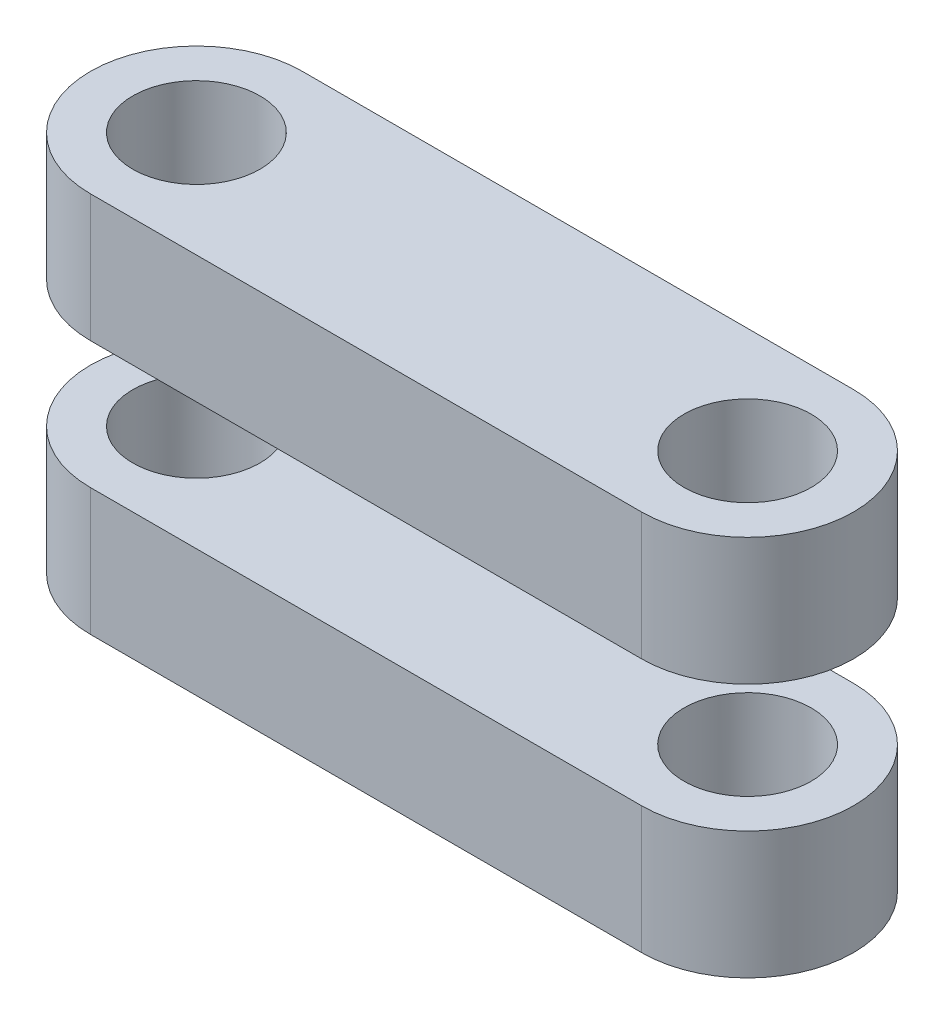
from build123d import *

# Parameters (mm, degrees)
SKETCH1_R           = 1.5
BOSS_EXTRUDE1_DEPTH = 9
SKETCH2_W           = 6
SKETCH2_H           = 3
CUT_EXTRUDE1_DEPTH  = 19.607794066
CHAMFER1_SIZE       = 1
SKETCH3_W           = 5
SKETCH3_H           = 3
CUT_EXTRUDE2_DEPTH  = 9


with BuildPart() as part:
    # Sketch1 → Boss-Extrude1 (new body)
    with BuildSketch(Plane(origin=(0, 0, 0), x_dir=(1, 0, 0), z_dir=(0, 1, 0))):
        with BuildLine():
            Line((0, 2.5), (13, 2.5))
            ThreePointArc((13, 2.5), (15.5, 0), (13, -2.5))
            Line((13, -2.5), (0, -2.5))
            ThreePointArc((0, -2.5), (-2.5, 0), (0, 2.5))
        make_face()
        with Locations(Location((0, 0, 0), (0, 0, 270))):
            Circle(SKETCH1_R, mode=Mode.SUBTRACT)
        with Locations(Location((13, 0, 0), (0, 0, 270))):
            Circle(SKETCH1_R, mode=Mode.SUBTRACT)
    extrude(amount=BOSS_EXTRUDE1_DEPTH)

    # Sketch2 → Cut-Extrude1 (cut, through all)
    with BuildSketch(Plane(origin=(0, 0, -2.5), x_dir=(-1, 0, 0), z_dir=(0, 0, -1))):
        with Locations((-13, 4.5)):
            Rectangle(SKETCH2_W, SKETCH2_H)
        with Locations((0, 4.5)):
            Rectangle(SKETCH2_W, SKETCH2_H)
    extrude(amount=-CUT_EXTRUDE1_DEPTH, mode=Mode.SUBTRACT)

    # Chamfer1
    chamfer1_edges = [part.edges().sort_by_distance(p)[0] for p in [
        (10, 4.5, 2.5),
        (10, 4.5, -2.5),
        (3, 4.5, -2.5),
        (3, 4.5, 2.5),
    ]]
    chamfer(chamfer1_edges, length=CHAMFER1_SIZE)

    # Sketch3 → Cut-Extrude2 (cut)
    with BuildSketch(Plane.ZY.offset(-3)):
        with Locations((0, 4.5)):
            Rectangle(SKETCH3_W, SKETCH3_H)
    extrude(amount=-CUT_EXTRUDE2_DEPTH, mode=Mode.SUBTRACT)


with BuildPart() as cut_extrude2_piece_1:
    # of the separate pieces the step leaves, piece 1, a body of its own (cut_extrude2_pieces)
    add(part.part.solids().sort_by_distance((13, 6, -2.5))[0])


with BuildPart() as cut_extrude2_piece_2:
    # of the separate pieces the step leaves, piece 2, a body of its own (cut_extrude2_pieces)
    add(part.part.solids().sort_by_distance((0, 3, -2.5))[0])


solid = Compound([cut_extrude2_piece_1.part, cut_extrude2_piece_2.part])
